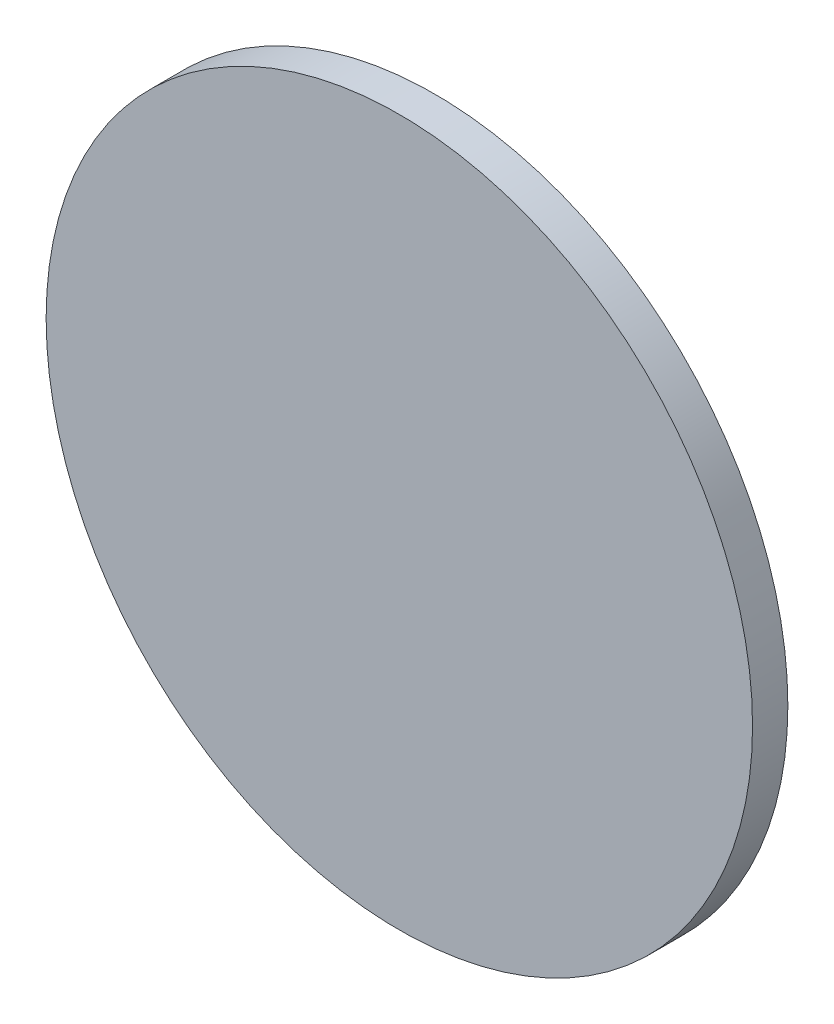
from build123d import *

# Parameters (mm, degrees)
SKETCH1_R           = 31.75
BOSS_EXTRUDE1_DEPTH = 3.175


with BuildPart() as part:
    # Sketch1 → Boss-Extrude1 (new body)
    with BuildSketch(Plane.XY):
        Circle(SKETCH1_R)
    extrude(amount=BOSS_EXTRUDE1_DEPTH)


solid = part.part
